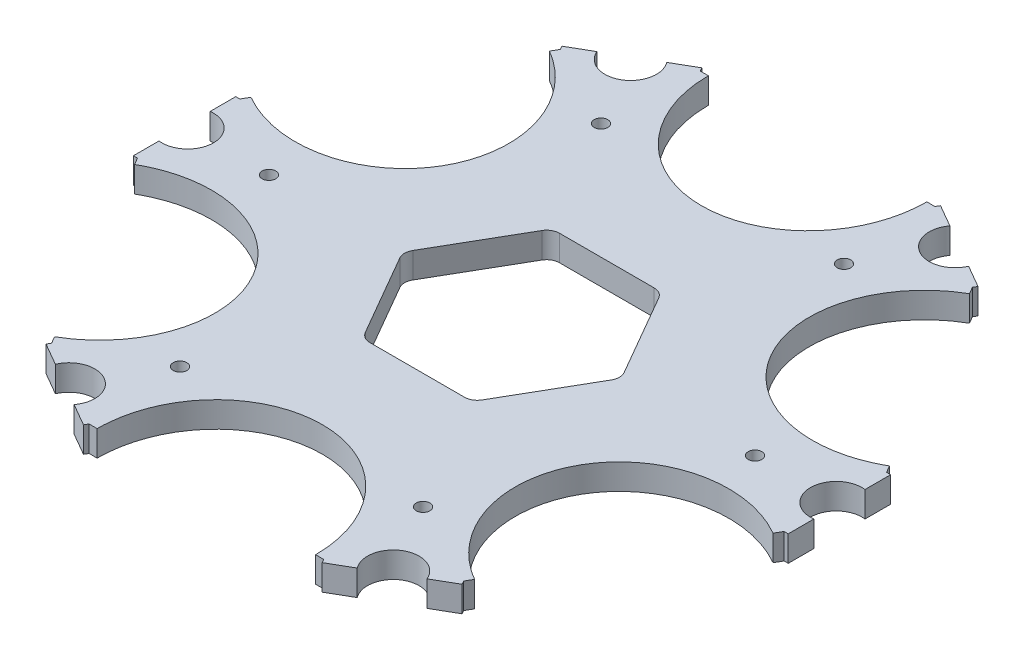
from build123d import *

# Parameters (mm, degrees)
SKETCH1_R           = 12.7
BOSS_EXTRUDE1_DEPTH = 2.38125
CUT_EXTRUDE1_DEPTH  = 83.900304501
FILLET1_R           = 3.175
SKETCH3_RX          = 21.59
SKETCH3_RY          = 20.32
CUT_EXTRUDE2_DEPTH  = 83.900304501
CIRPATTERN1_COUNT   = 6
SKETCH4_R           = 1.27
CUT_EXTRUDE3_DEPTH  = 83.900304648
CIRPATTERN2_COUNT   = 6
BOSS_EXTRUDE2_DEPTH = 4.7625


with BuildPart() as part:
    # Sketch1 → Boss-Extrude1 (new, symmetric)
    with BuildSketch(Plane(origin=(0, 0, 0), x_dir=(1, 0, 0), z_dir=(0, 1, 0))):
        with BuildLine():
            Line((-60.1472, 5.553404471), (-60.1472, 9.525))
            Line((-60.1472, 9.525), (-38.322491971, 47.326503167))
            Line((-38.322491971, 47.326503167), (-34.88298935, 49.312300931))
            ThreePointArc((-34.88298935, 49.312300931), (-27.384375, 47.431128834), (-25.26421065, 54.865705402))
            Line((-25.26421065, 54.865705402), (-21.824708029, 56.851503167))
            Line((-21.824708029, 56.851503167), (21.824708029, 56.851503167))
            Line((21.824708029, 56.851503167), (25.26421065, 54.865705402))
            ThreePointArc((25.26421065, 54.865705402), (27.384375, 47.431128834), (34.88298935, 49.312300931))
            Line((34.88298935, 49.312300931), (38.322491971, 47.326503167))
            Line((38.322491971, 47.326503167), (60.1472, 9.525))
            Line((60.1472, 9.525), (60.1472, 5.553404471))
            ThreePointArc((60.1472, 5.553404471), (54.76875, 0), (60.1472, -5.553404471))
            Line((60.1472, -5.553404471), (60.1472, -9.525))
            Line((60.1472, -9.525), (38.322491971, -47.326503167))
            Line((38.322491971, -47.326503167), (34.88298935, -49.312300931))
            ThreePointArc((34.88298935, -49.312300931), (27.384375, -47.431128834), (25.26421065, -54.865705402))
            Line((25.26421065, -54.865705402), (21.824708029, -56.851503167))
            Line((21.824708029, -56.851503167), (-21.824708029, -56.851503167))
            Line((-21.824708029, -56.851503167), (-25.26421065, -54.865705402))
            ThreePointArc((-25.26421065, -54.865705402), (-27.384375, -47.431128834), (-34.88298935, -49.312300931))
            Line((-34.88298935, -49.312300931), (-38.322491971, -47.326503167))
            Line((-38.322491971, -47.326503167), (-60.1472, -9.525))
            Line((-60.1472, -9.525), (-60.1472, -5.553404471))
            ThreePointArc((-60.1472, -5.553404471), (-54.76875, 0), (-60.1472, 5.553404471))
        make_face()
        with Locations(Location((0, 0, 0), (0, 0, 90))):
            Circle(SKETCH1_R, mode=Mode.SUBTRACT)
    extrude(amount=BOSS_EXTRUDE1_DEPTH, both=True)

    # Sketch2 → Cut-Extrude1 (cut, through all)
    with BuildSketch(Plane(origin=(0, 2.38125, 0), x_dir=(1, 0, 0), z_dir=(0, 1, 0))):
        Polygon((10.61724051, -18.3896), (21.234481021, 0), (10.61724051, 18.3896), (-10.61724051, 18.3896), (-21.234481021, 0), (-10.61724051, -18.3896), align=None)
    extrude(amount=-CUT_EXTRUDE1_DEPTH, mode=Mode.SUBTRACT)

    # Fillet1
    fillet1_edges = [part.edges().sort_by_distance(p)[0] for p in [
        (10.61724051, 0, 18.3896),
        (-10.61724051, 0, 18.3896),
        (-21.234481021, 0, 0),
        (-10.61724051, 0, -18.3896),
        (10.61724051, 0, -18.3896),
        (21.234481021, 0, 0),
    ]]
    fillet(fillet1_edges, radius=FILLET1_R)

    # Sketch3 → Cut-Extrude2 (cut, through all)
    with BuildSketch(Plane(origin=(0, 2.38125, 0), x_dir=(1, 0, 0), z_dir=(0, 1, 0))):
        with Locations(Location((0, -56.851503167), (0, 0, -90))):
            Ellipse(SKETCH3_RX, SKETCH3_RY)
    cut_extrude2 = extrude(amount=-CUT_EXTRUDE2_DEPTH, mode=Mode.SUBTRACT)

    # CirPattern1: Cut-Extrude2 ×6 about axis
    cirpattern1_axis = Axis((0, -55, 0), (0, 1, 0))
    for i in range(1, CIRPATTERN1_COUNT):
        add(cut_extrude2.rotate(cirpattern1_axis, i * 360 / CIRPATTERN1_COUNT), mode=Mode.SUBTRACT)

    # Sketch4 → Cut-Extrude3 (cut, through all)
    with BuildSketch(Plane(origin=(0, 2.38125, 0), x_dir=(1, 0, 0), z_dir=(0, 1, 0))):
        with Locations(Location((45.212, 0, 0), (0, 0, 270))):
            Circle(SKETCH4_R)
    cut_extrude3 = extrude(amount=-CUT_EXTRUDE3_DEPTH, mode=Mode.SUBTRACT)

    # CirPattern2: Cut-Extrude3 ×6 about axis
    cirpattern2_axis = Axis((0, 0, 0), (0, 1, 0))
    for i in range(1, CIRPATTERN2_COUNT):
        add(cut_extrude3.rotate(cirpattern2_axis, i * 360 / CIRPATTERN2_COUNT), mode=Mode.SUBTRACT)

    # Sketch6 → Boss-Extrude2 (add)
    # profile 1 of 7: a face of its own
    with BuildSketch(Plane(origin=(0, 2.38125, 0), x_dir=(1, 0, 0), z_dir=(0, 1, 0))):
        with BuildLine():
            Line((11.533784063, -16.8021), (20.317937468, -1.5875))
            ThreePointArc((20.317937468, -1.5875), (20.743306811, 0), (20.317937468, 1.5875))
            Line((20.317937468, 1.5875), (11.533784063, 16.8021))
            ThreePointArc((11.533784063, 16.8021), (10.371653406, 17.964230657), (8.784153406, 18.3896))
            Line((8.784153406, 18.3896), (-8.784153406, 18.3896))
            ThreePointArc((-8.784153406, 18.3896), (-10.371653406, 17.964230657), (-11.533784063, 16.8021))
            Line((-11.533784063, 16.8021), (-20.317937468, 1.5875))
            ThreePointArc((-20.317937468, 1.5875), (-20.743306811, 0), (-20.317937468, -1.5875))
            Line((-20.317937468, -1.5875), (-11.533784063, -16.8021))
            ThreePointArc((-11.533784063, -16.8021), (-10.371653406, -17.964230657), (-8.784153406, -18.3896))
            Line((-8.784153406, -18.3896), (8.784153406, -18.3896))
            ThreePointArc((8.784153406, -18.3896), (10.371653406, -17.964230657), (11.533784063, -16.8021))
        make_face()
        with BuildLine():
            Line((19.658026111, 1.2065), (10.873872705, 16.4211))
            ThreePointArc((10.873872705, 16.4211), (9.990653406, 17.304319299), (8.784153406, 17.6276))
            Line((8.784153406, 17.6276), (-8.784153406, 17.6276))
            ThreePointArc((-8.784153406, 17.6276), (-9.990653406, 17.304319299), (-10.873872705, 16.4211))
            Line((-10.873872705, 16.4211), (-19.658026111, 1.2065))
            ThreePointArc((-19.658026111, 1.2065), (-19.981306811, 0), (-19.658026111, -1.2065))
            Line((-19.658026111, -1.2065), (-10.873872705, -16.4211))
            ThreePointArc((-10.873872705, -16.4211), (-9.990653406, -17.304319299), (-8.784153406, -17.6276))
            Line((-8.784153406, -17.6276), (8.784153406, -17.6276))
            ThreePointArc((8.784153406, -17.6276), (9.990653406, -17.304319299), (10.873872705, -16.4211))
            Line((10.873872705, -16.4211), (19.658026111, -1.2065))
            ThreePointArc((19.658026111, -1.2065), (19.981306811, 0), (19.658026111, 1.2065))
        make_face(mode=Mode.SUBTRACT)
    # profile 2 of 7: a face of its own
    with BuildSketch(Plane(origin=(0, 2.38125, 0), x_dir=(1, 0, 0), z_dir=(0, 1, 0))):
        with BuildLine():
            Line((-60.1472, -5.553404471), (-60.1472, -9.525))
            Line((-60.1472, -9.525), (-60.9092, -9.525))
            Line((-60.9092, -9.525), (-60.9092, -4.75852324))
            ThreePointArc((-60.9092, -4.75852324), (-55.53075, 0), (-60.9092, 4.75852324))
            Line((-60.9092, 4.75852324), (-60.9092, 9.525))
            Line((-60.9092, 9.525), (-60.1472, 9.525))
            Line((-60.1472, 9.525), (-60.1472, 5.553404471))
            ThreePointArc((-60.1472, 5.553404471), (-54.76875, 0), (-60.1472, -5.553404471))
        make_face()
    # profile 3 of 7: a face of its own
    with BuildSketch(Plane(origin=(0, 2.38125, 0), x_dir=(1, 0, 0), z_dir=(0, 1, 0))):
        with BuildLine():
            Line((-34.88298935, 49.312300931), (-38.322491971, 47.326503167))
            Line((-38.322491971, 47.326503167), (-38.703491971, 47.986414524))
            Line((-38.703491971, 47.986414524), (-34.57560201, 50.369652904))
            ThreePointArc((-34.57560201, 50.369652904), (-27.765375, 48.091040191), (-26.33359799, 55.128176144))
            Line((-26.33359799, 55.128176144), (-22.205708029, 57.511414524))
            Line((-22.205708029, 57.511414524), (-21.824708029, 56.851503167))
            Line((-21.824708029, 56.851503167), (-25.26421065, 54.865705402))
            ThreePointArc((-25.26421065, 54.865705402), (-27.384375, 47.431128834), (-34.88298935, 49.312300931))
        make_face()
    # profile 4 of 7: a face of its own
    with BuildSketch(Plane(origin=(0, 2.38125, 0), x_dir=(1, 0, 0), z_dir=(0, 1, 0))):
        with BuildLine():
            Line((25.26421065, 54.865705402), (21.824708029, 56.851503167))
            Line((21.824708029, 56.851503167), (22.205708029, 57.511414524))
            Line((22.205708029, 57.511414524), (26.33359799, 55.128176144))
            ThreePointArc((26.33359799, 55.128176144), (27.765375, 48.091040191), (34.57560201, 50.369652904))
            Line((34.57560201, 50.369652904), (38.703491971, 47.986414524))
            Line((38.703491971, 47.986414524), (38.322491971, 47.326503167))
            Line((38.322491971, 47.326503167), (34.88298935, 49.312300931))
            ThreePointArc((34.88298935, 49.312300931), (27.384375, 47.431128834), (25.26421065, 54.865705402))
        make_face()
    # profile 5 of 7: a face of its own
    with BuildSketch(Plane(origin=(0, 2.38125, 0), x_dir=(1, 0, 0), z_dir=(0, 1, 0))):
        with BuildLine():
            Line((60.1472, 5.553404471), (60.1472, 9.525))
            Line((60.1472, 9.525), (60.9092, 9.525))
            Line((60.9092, 9.525), (60.9092, 4.75852324))
            ThreePointArc((60.9092, 4.75852324), (55.53075, 0), (60.9092, -4.75852324))
            Line((60.9092, -4.75852324), (60.9092, -9.525))
            Line((60.9092, -9.525), (60.1472, -9.525))
            Line((60.1472, -9.525), (60.1472, -5.553404471))
            ThreePointArc((60.1472, -5.553404471), (54.76875, 0), (60.1472, 5.553404471))
        make_face()
    # profile 6 of 7: a face of its own
    with BuildSketch(Plane(origin=(0, 2.38125, 0), x_dir=(1, 0, 0), z_dir=(0, 1, 0))):
        with BuildLine():
            Line((34.88298935, -49.312300931), (38.322491971, -47.326503167))
            Line((38.322491971, -47.326503167), (38.703491971, -47.986414524))
            Line((38.703491971, -47.986414524), (34.57560201, -50.369652904))
            ThreePointArc((34.57560201, -50.369652904), (27.765375, -48.091040191), (26.33359799, -55.128176144))
            Line((26.33359799, -55.128176144), (22.205708029, -57.511414524))
            Line((22.205708029, -57.511414524), (21.824708029, -56.851503167))
            Line((21.824708029, -56.851503167), (25.26421065, -54.865705402))
            ThreePointArc((25.26421065, -54.865705402), (27.384375, -47.431128834), (34.88298935, -49.312300931))
        make_face()
    # profile 7 of 7: a face of its own
    with BuildSketch(Plane(origin=(0, 2.38125, 0), x_dir=(1, 0, 0), z_dir=(0, 1, 0))):
        with BuildLine():
            Line((-25.26421065, -54.865705402), (-21.824708029, -56.851503167))
            Line((-21.824708029, -56.851503167), (-22.205708029, -57.511414524))
            Line((-22.205708029, -57.511414524), (-26.33359799, -55.128176144))
            ThreePointArc((-26.33359799, -55.128176144), (-27.765375, -48.091040191), (-34.57560201, -50.369652904))
            Line((-34.57560201, -50.369652904), (-38.703491971, -47.986414524))
            Line((-38.703491971, -47.986414524), (-38.322491971, -47.326503167))
            Line((-38.322491971, -47.326503167), (-34.88298935, -49.312300931))
            ThreePointArc((-34.88298935, -49.312300931), (-27.384375, -47.431128834), (-25.26421065, -54.865705402))
        make_face()
    extrude(amount=-BOSS_EXTRUDE2_DEPTH)


solid = part.part
